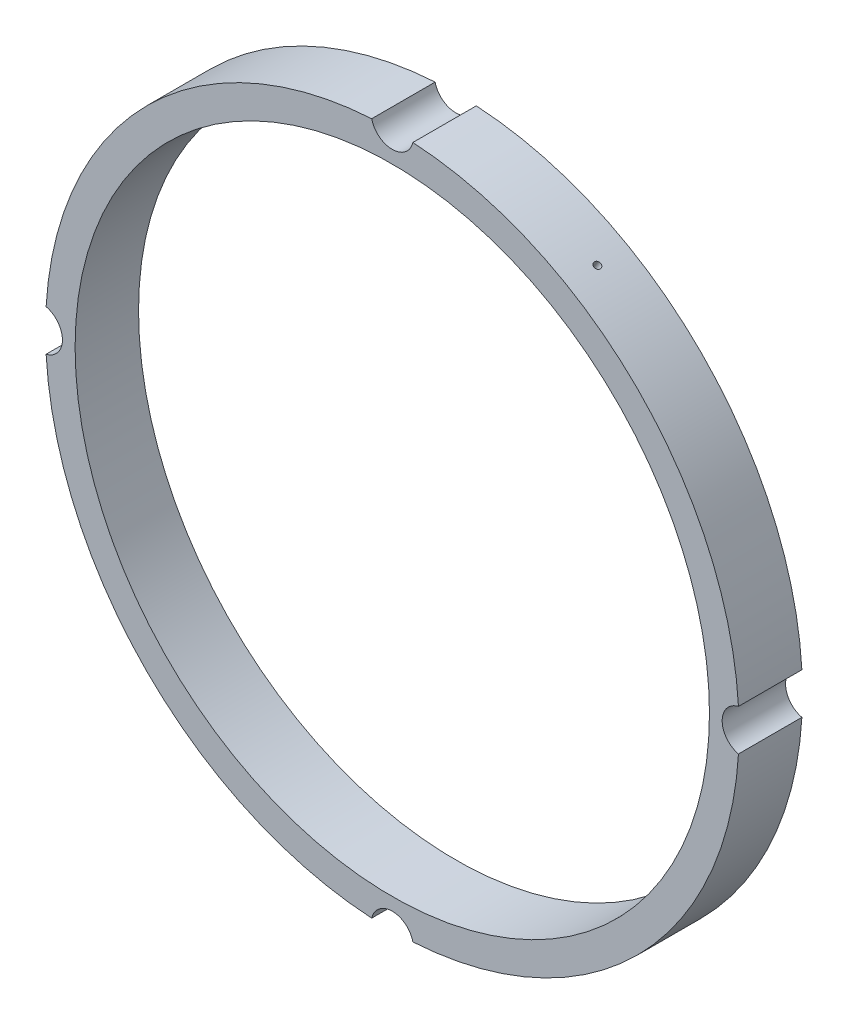
from build123d import *

# Parameters (mm, degrees)
SKETCH1_R                 = 82
SKETCH1_R_2               = 75
BOSS_EXTRUDE1_DEPTH       = 15
SKETCH2_R                 = 5
CUT_EXTRUDE1_DEPTH        = 117.93160394
CIRPATTERN1_COUNT         = 4
M2X0_4_TAPPED_HOLE1_D     = 1.6
M2X0_4_TAPPED_HOLE1_DEPTH = 10
M2X0_4_TAPPED_HOLE1_TIP   = 0.480688495


with BuildPart() as part:
    # Sketch1 → Boss-Extrude1 (new body)
    with BuildSketch(Plane.XY):
        Circle(SKETCH1_R)
        Circle(SKETCH1_R_2, mode=Mode.SUBTRACT)
    extrude(amount=BOSS_EXTRUDE1_DEPTH)

    # Sketch2 → Cut-Extrude1 (cut, through all)
    with BuildSketch(Plane.XY.offset(15)):
        with Locations((0, 83)):
            Circle(SKETCH2_R)
    cut_extrude1 = extrude(amount=-CUT_EXTRUDE1_DEPTH, mode=Mode.SUBTRACT)

    # CirPattern1: Cut-Extrude1 ×4 about axis
    cirpattern1_axis = Axis((0, 0, 0), (0, 0, 1))
    for i in range(1, CIRPATTERN1_COUNT):
        add(cut_extrude1.rotate(cirpattern1_axis, i * 360 / CIRPATTERN1_COUNT), mode=Mode.SUBTRACT)

    # M2x0.4 Tapped Hole1
    with Locations(Plane(origin=(41, 71.01408311, 7.5), x_dir=(0.866025403784, -0.5, 0), z_dir=(0.5, 0.866025403784, 0))):
        with Locations((0, 0)):
            Hole(M2X0_4_TAPPED_HOLE1_D / 2, depth=M2X0_4_TAPPED_HOLE1_DEPTH)
            with Locations((0, 0, -(M2X0_4_TAPPED_HOLE1_DEPTH + M2X0_4_TAPPED_HOLE1_TIP / 2))):  # 118° drill point
                Cone(0, M2X0_4_TAPPED_HOLE1_D / 2, M2X0_4_TAPPED_HOLE1_TIP, mode=Mode.SUBTRACT)


solid = part.part
